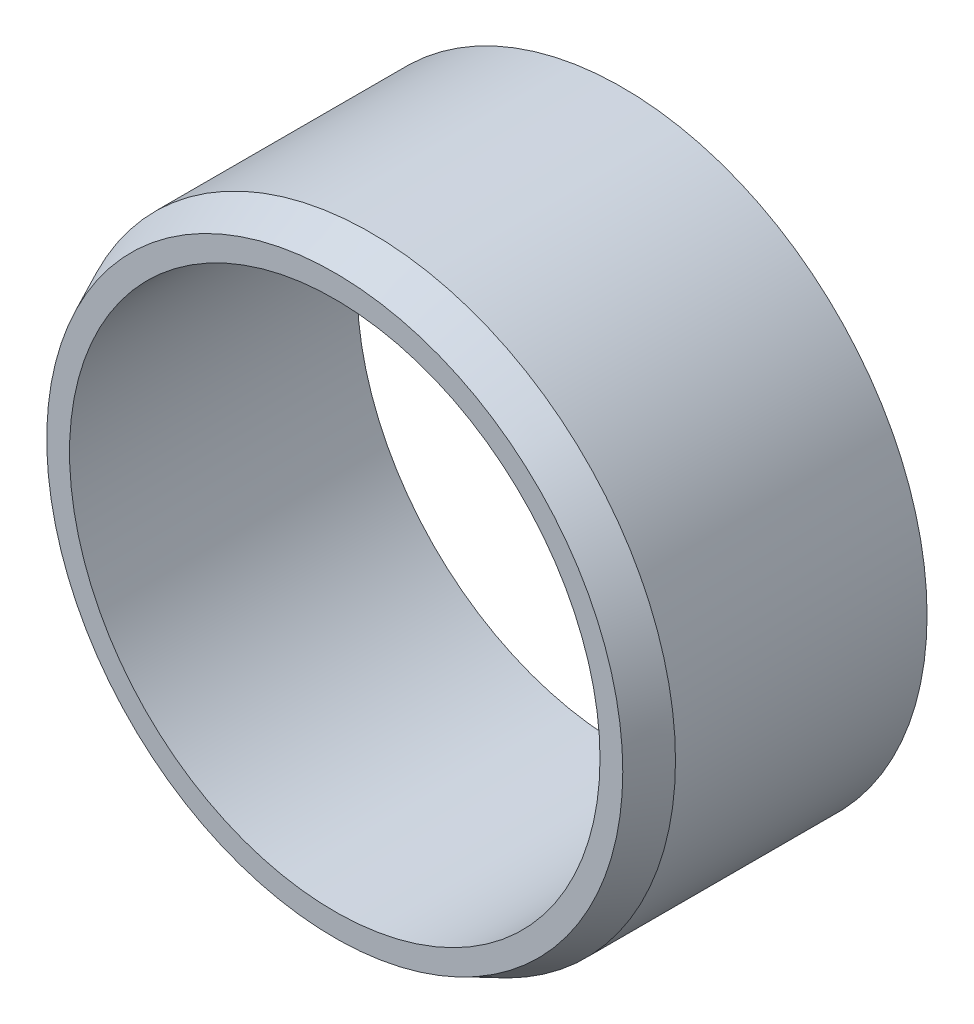
from build123d import *

# Parameters (mm, degrees)
SKETCH1_R           = 10.6
SKETCH1_R_2         = 9.225
BOSS_EXTRUDE1_DEPTH = 10
CHAMFER1_SIZE       = 1.25
CHAMFER1_SIZE2      = 0.582884573


with BuildPart() as part:
    # Sketch1 → Boss-Extrude1 (new body)
    with BuildSketch(Plane.XY):
        Circle(SKETCH1_R)
        Circle(SKETCH1_R_2, mode=Mode.SUBTRACT)
    extrude(amount=BOSS_EXTRUDE1_DEPTH)

    # Chamfer1
    chamfer1_edges = [part.edges().sort_by_distance(p)[0] for p in [
        (-10.6, 0, 10),
    ]]
    chamfer1_side = [part.faces().sort_by_distance(p)[0] for p in [
        (-10.6, 0, 5),
    ]]
    chamfer(chamfer1_edges, length=CHAMFER1_SIZE, length2=CHAMFER1_SIZE2, reference=chamfer1_side[0])


solid = part.part
